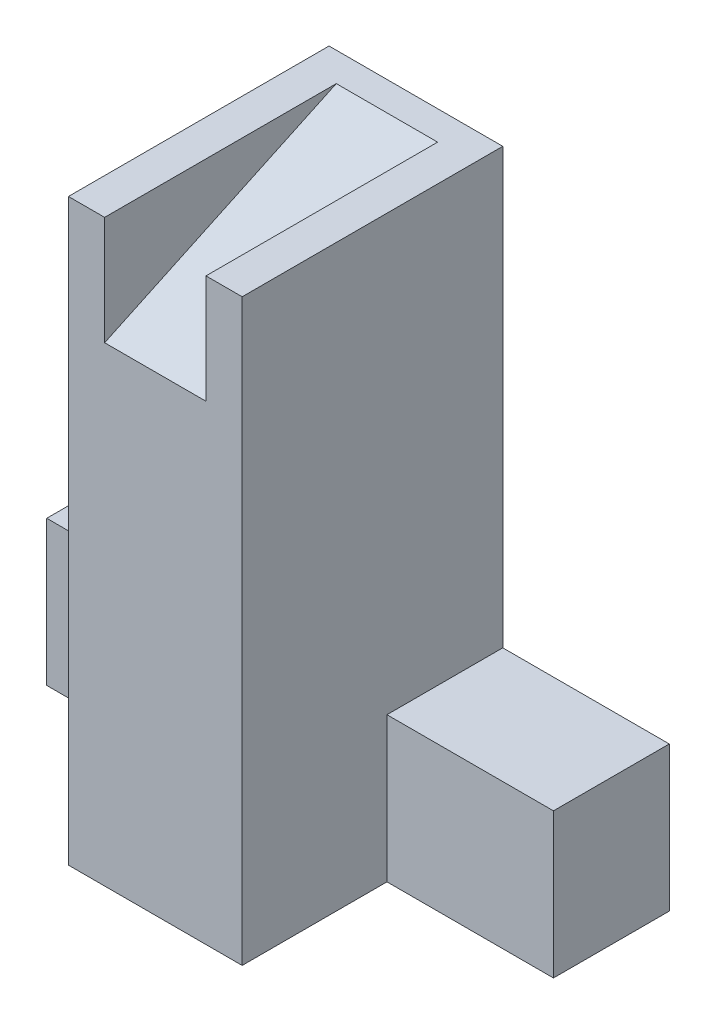
from build123d import *

# Parameters (mm, degrees)
SKETCH1_W           = 24000
SKETCH1_H           = 80000
BOSS_EXTRUDE1_DEPTH = 36000
CUT_EXTRUDE1_START  = -5000
CUT_EXTRUDE1_DEPTH  = 14000
SKETCH3_W           = 23000
SKETCH3_H           = 20000
BOSS_EXTRUDE2_DEPTH = 16000


with BuildPart() as part:
    # Sketch1 → Boss-Extrude1 (new body)
    with BuildSketch(Plane.XY):
        with Locations((12000, 40000)):
            Rectangle(SKETCH1_W, SKETCH1_H)
    extrude(amount=BOSS_EXTRUDE1_DEPTH)

    # Sketch2 → Cut-Extrude1 (cut)
    with BuildSketch(Plane(origin=(24000, 0, 0), x_dir=(0, 0, -1), z_dir=(1, 0, 0)).offset(CUT_EXTRUDE1_START)):
        Polygon((-36000, 80000), (-4000, 80000), (-36000, 65000), align=None)
    extrude(amount=-CUT_EXTRUDE1_DEPTH, mode=Mode.SUBTRACT)

    # Sketch3 → Boss-Extrude2 (add)
    with BuildSketch(Plane(origin=(0, 0, 0), x_dir=(-1, 0, 0), z_dir=(0, 0, -1))):
        with Locations((-35500, 10000)):
            Rectangle(SKETCH3_W, SKETCH3_H)
        with Locations((11500, 10000)):
            Rectangle(SKETCH3_W, SKETCH3_H)
    extrude(amount=-BOSS_EXTRUDE2_DEPTH)


solid = part.part
